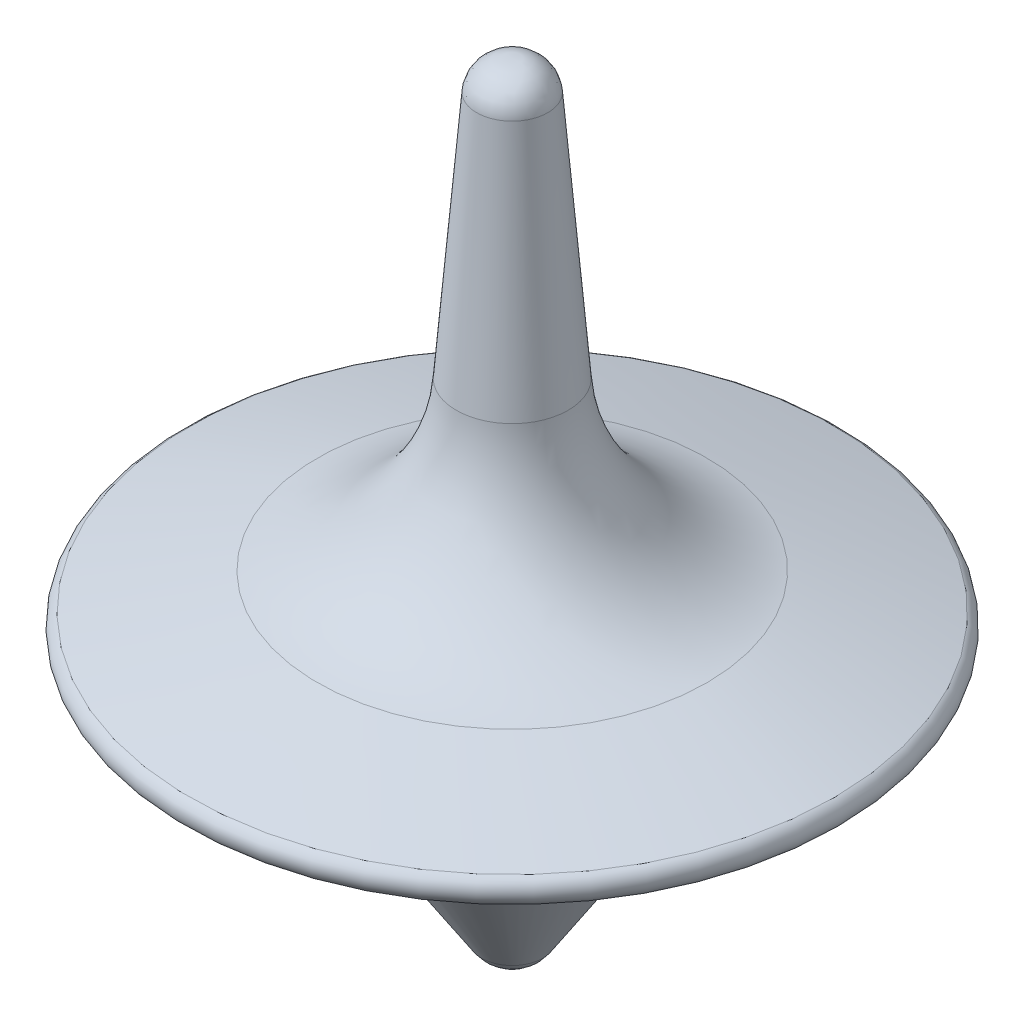
from build123d import *


with BuildPart() as part:
    # Esboço1 → Revolução1 (revolve)
    with BuildSketch(Plane.XY):
        with BuildLine():
            Line((1.016555702, -17.534294806), (1.016555702, 16.265705194))
            ThreePointArc((1.016555702, 16.265705194), (2.06121806, 15.973437857), (2.553565234, 15.006828371))
            ThreePointArc((2.553565234, 15.006828371), (2.92828475, 9.651459509), (3.433565234, 4.306828371))
            ThreePointArc((3.433565234, 4.306828371), (5.268808127, -0.263802551), (9.433565234, -2.893171629))
            ThreePointArc((9.433565234, -2.893171629), (12.192236118, -3.637403975), (14.933565234, -4.443171629))
            ThreePointArc((14.933565234, -4.443171629), (15.258578175, -5.111100137), (14.721555702, -5.624294806))
            ThreePointArc((14.721555702, -5.624294806), (12.658414234, -6.31213617), (10.621555702, -7.074294806))
            ThreePointArc((10.621555702, -7.074294806), (8.276967202, -8.358909194), (6.486555702, -10.344294806))
            ThreePointArc((6.486555702, -10.344294806), (4.488079996, -13.598838615), (2.336555702, -16.754294806))
            ThreePointArc((2.336555702, -16.754294806), (1.76887547, -17.300528258), (1.016555702, -17.534294806))
        make_face()
    revolve(axis=Axis((1.016555702, -17.534294806, 0), (0, 1, 0)))


solid = part.part
